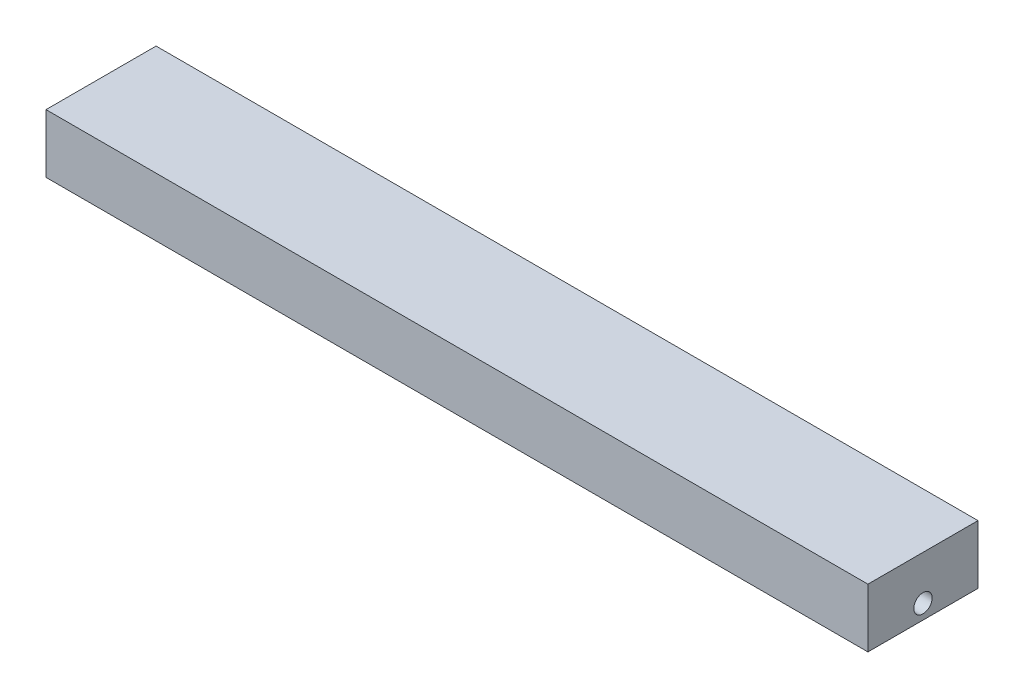
from build123d import *

# Parameters (mm, degrees)
SKIZZE1_W                       = 112
SKIZZE1_H                       = 15
AUFSATZ_LINEAR_AUSTRAGEN1_DEPTH = 8
SKIZZE2_R                       = 1.25
SCHNITT_LINEAR_AUSTRAGEN1_DEPTH = 113.535549939


with BuildPart() as part:
    # Skizze1 → Aufsatz-Linear austragen1 (new body)
    with BuildSketch(Plane(origin=(0, 0, 0), x_dir=(1, 0, 0), z_dir=(0, 1, 0))):
        Rectangle(SKIZZE1_W, SKIZZE1_H)
    extrude(amount=AUFSATZ_LINEAR_AUSTRAGEN1_DEPTH)

    # Skizze2 → Schnitt-Linear austragen1 (cut, through all)
    with BuildSketch(Plane(origin=(56, 0, 0), x_dir=(0, 0, -1), z_dir=(1, 0, 0))):
        with Locations((0, 2)):
            Circle(SKIZZE2_R)
    extrude(amount=-SCHNITT_LINEAR_AUSTRAGEN1_DEPTH, mode=Mode.SUBTRACT)


solid = part.part
